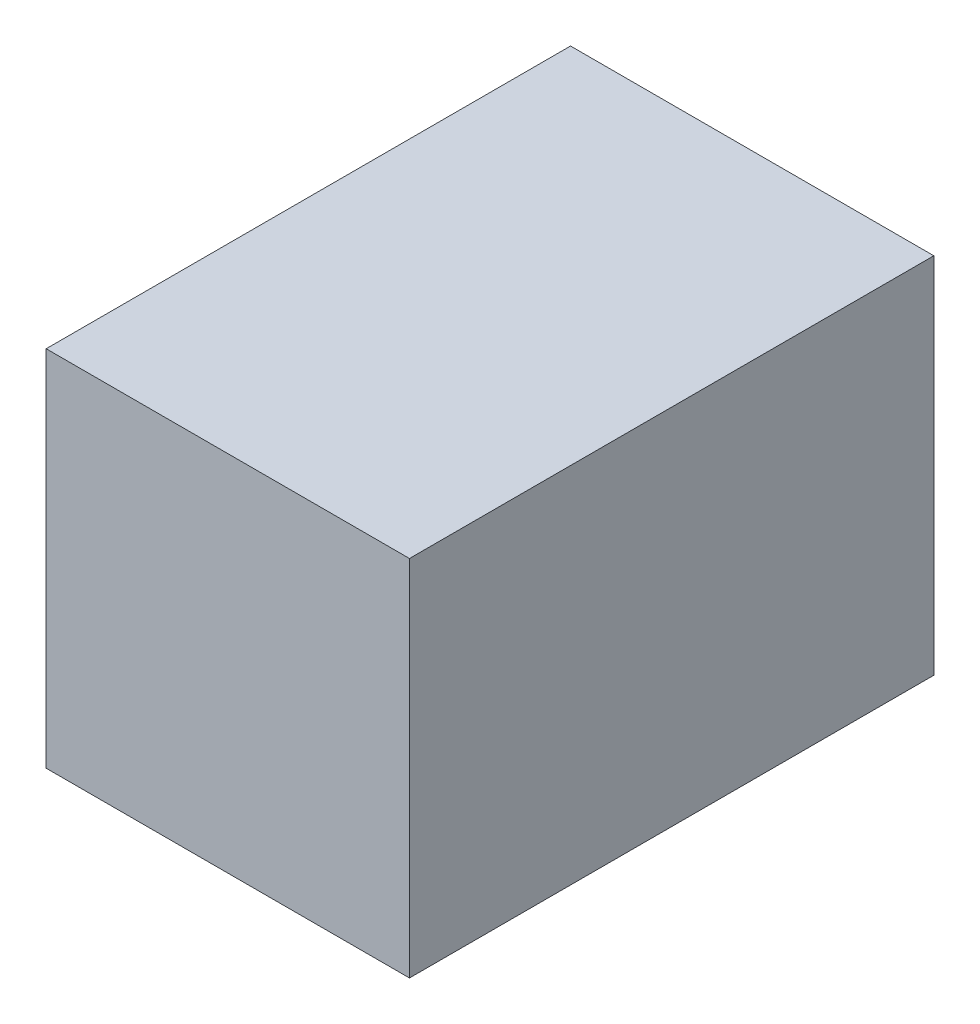
from build123d import *

# Parameters (mm, degrees)
SKETCH1_W               = 6.603
SKETCH1_H               = 6.6031
COMPONENT_OUTLINE_DEPTH = 9.53


with BuildPart() as part:
    # Sketch1 → Component_Outline (new body)
    with BuildSketch(Plane.XY):
        with Locations((0, 5e-05)):
            Rectangle(SKETCH1_W, SKETCH1_H)
    extrude(amount=COMPONENT_OUTLINE_DEPTH)


solid = part.part
